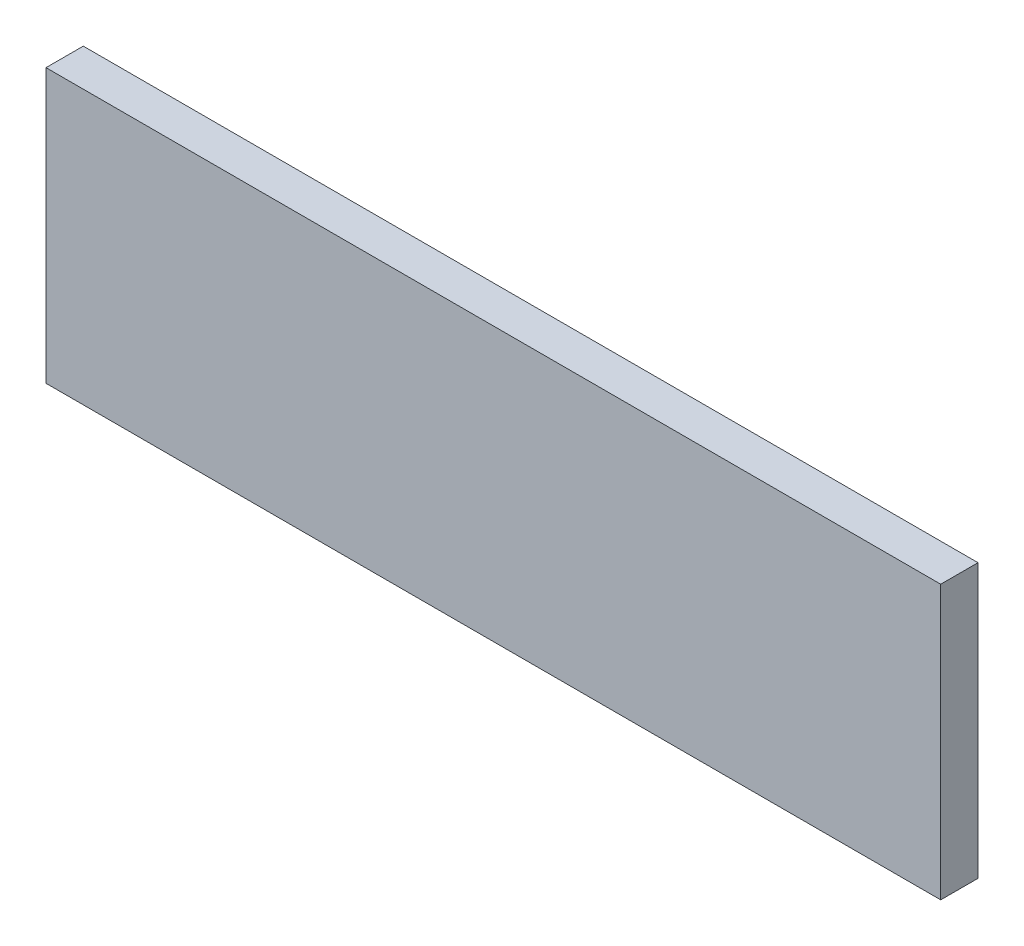
from build123d import *

# Parameters (mm, degrees)
SKETCH2_W           = 114.3
SKETCH2_H           = 34.925
BOSS_EXTRUDE1_DEPTH = 4.7625


with BuildPart() as part:
    # Sketch2 → Boss-Extrude1 (new body)
    with BuildSketch(Plane.XY):
        with Locations((-4.7625, 1.5875)):
            Rectangle(SKETCH2_W, SKETCH2_H)
    extrude(amount=BOSS_EXTRUDE1_DEPTH)


solid = part.part
